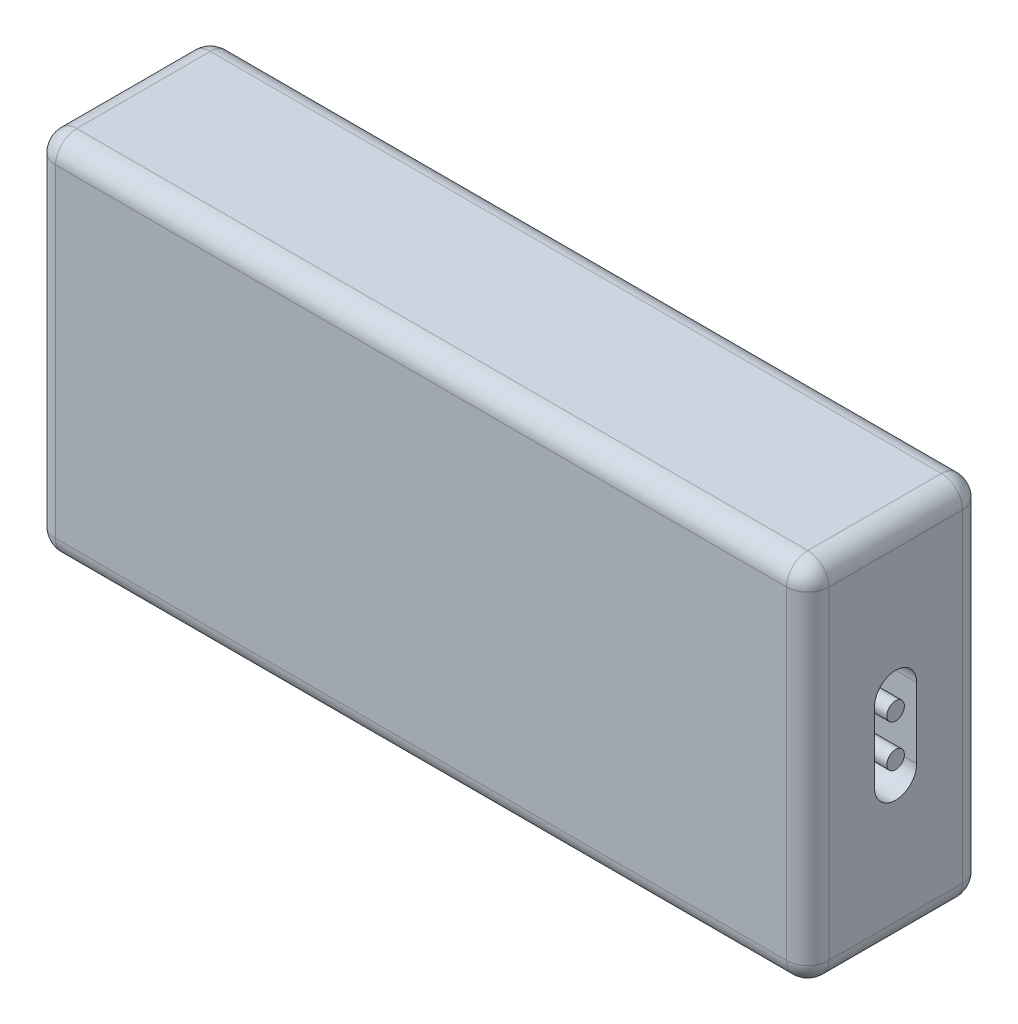
from build123d import *

# Parameters (mm, degrees)
SKETCH_1_W          = 110
SKETCH_1_H          = 52
EXTRUDE_1_DEPTH     = 25
SKETCH_2_R          = 1.25
CUT_EXTRUDE_1_DEPTH = 6
SKETCH_3_W          = 4
SKETCH_3_H          = 10
CUT_EXTRUDE_2_DEPTH = 6
SKETCH_4_W          = 4
SKETCH_4_H          = 10
CUT_EXTRUDE_3_DEPTH = 6
SKETCH_5_W          = 17
SKETCH_5_H          = 8
CUT_EXTRUDE_4_DEPTH = 2
FILLET_1_R          = 3


with BuildPart() as part:
    # Эскиз1 → Бобышка-Вытянуть1 (new body)
    with BuildSketch(Plane.XY):
        with Locations((55, 26)):
            Rectangle(SKETCH_1_W, SKETCH_1_H)
    extrude(amount=EXTRUDE_1_DEPTH)

    # Эскиз2 → Вырез-Вытянуть1 (cut)
    with BuildSketch(Plane(origin=(110, 0, 0), x_dir=(0, 0, -1), z_dir=(1, 0, 0))):
        with BuildLine():
            Line((-9.5, 31), (-9.5, 21))
            ThreePointArc((-9.5, 21), (-12.5, 18), (-15.5, 21))
            Line((-15.5, 21), (-15.5, 31))
            ThreePointArc((-15.5, 31), (-12.5, 34), (-9.5, 31))
        make_face()
        with Locations(Location((-12.5, 29, 0), (0, 0, 90))):
            Circle(SKETCH_2_R, mode=Mode.SUBTRACT)
        with Locations(Location((-12.5, 23, 0), (0, 0, 90))):
            Circle(SKETCH_2_R, mode=Mode.SUBTRACT)
    extrude(amount=-CUT_EXTRUDE_1_DEPTH, mode=Mode.SUBTRACT)

    # Эскиз3 → Вырез-Вытянуть2 (cut)
    with BuildSketch(Plane.ZY):
        with Locations((12.5, 9)):
            Rectangle(SKETCH_3_W, SKETCH_3_H)
    extrude(amount=-CUT_EXTRUDE_2_DEPTH, mode=Mode.SUBTRACT)

    # Эскиз4 → Вырез-Вытянуть3 (cut)
    with BuildSketch(Plane.ZY):
        with Locations((12.5, 43)):
            Rectangle(SKETCH_4_W, SKETCH_4_H)
    extrude(amount=-CUT_EXTRUDE_3_DEPTH, mode=Mode.SUBTRACT)

    # Эскиз5 → Вырез-Вытянуть4 (cut)
    with BuildSketch(Plane(origin=(0, 0, 0), x_dir=(-1, 0, 0), z_dir=(0, 0, -1))):
        with Locations((-23.5, 9)):
            Rectangle(SKETCH_5_W, SKETCH_5_H)
    extrude(amount=-CUT_EXTRUDE_4_DEPTH, mode=Mode.SUBTRACT)

    # Скругление1
    fillet_1_edges = [part.edges().sort_by_distance(p)[0] for p in [
        (110, 26, 25),
        (55, 52, 25),
        (0, 26, 25),
        (55, 52, 0),
        (110, 26, 0),
        (55, 0, 0),
        (0, 26, 0),
        (55, 0, 25),
        (0, 52, 12.5),
        (110, 52, 12.5),
        (110, 0, 12.5),
        (0, 0, 12.5),
    ]]
    fillet(fillet_1_edges, radius=FILLET_1_R)


solid = part.part
